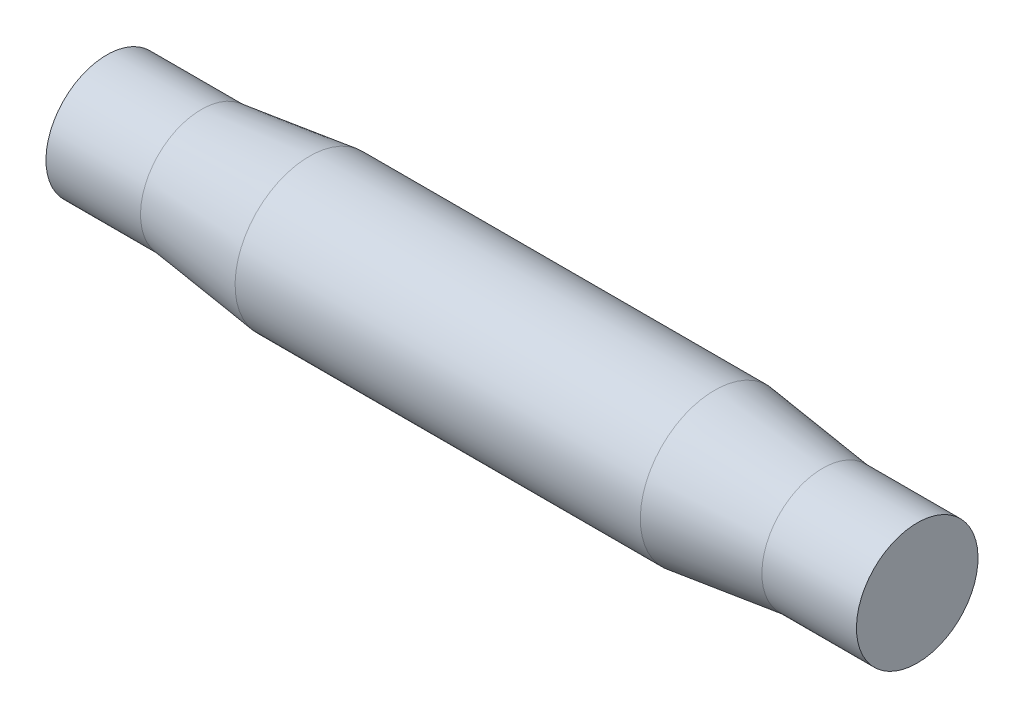
from build123d import *


with BuildPart() as part:
    # Esquisse1 → Révolution1 (revolve)
    with BuildSketch(Plane.XY, mode=Mode.PRIVATE) as r_volution1_sk:
        Polygon((-30, 0), (30, 0), (30, 4.5), (23, 4.5), (15, 5.5), (-15, 5.5), (-23, 4.5), (-30, 4.5), align=None)
    revolve(r_volution1_sk.sketch.rotate(Axis((-30, 0, 0), (1, 0, 0)), 180), axis=Axis((-30, 0, 0), (1, 0, 0)))


solid = part.part
